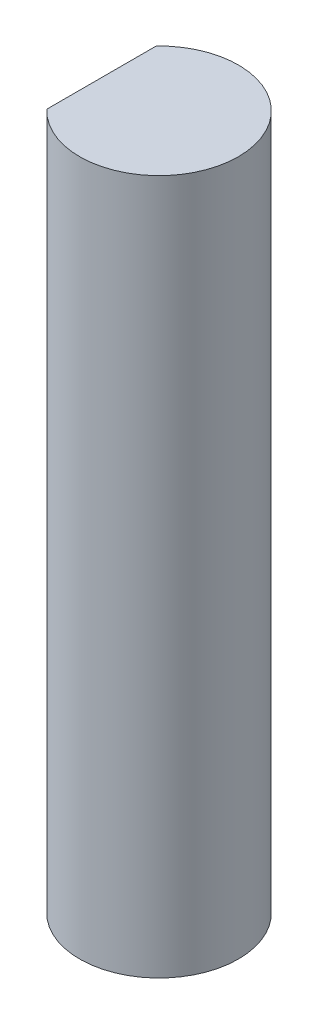
from build123d import *

# Parameters (mm, degrees)
SKETCH1_R           = 4
BOSS_EXTRUDE1_DEPTH = 35
SKETCH2_W           = 1.759330948
SKETCH2_H           = 6.654549559
CUT_EXTRUDE1_DEPTH  = 36.454195802


with BuildPart() as part:
    # Sketch1 → Boss-Extrude1 (new body)
    with BuildSketch(Plane(origin=(0, 0, 0), x_dir=(1, 0, 0), z_dir=(0, 1, 0))):
        with Locations(Location((0, 0, 0), (0, 0, 270))):
            Circle(SKETCH1_R)
    extrude(amount=BOSS_EXTRUDE1_DEPTH)

    # Sketch2 → Cut-Extrude1 (cut, through all)
    with BuildSketch(Plane.XZ):
        with Locations((-3.778649265, -0.433709649)):
            Rectangle(SKETCH2_W, SKETCH2_H)
    extrude(amount=-CUT_EXTRUDE1_DEPTH, mode=Mode.SUBTRACT)


solid = part.part
